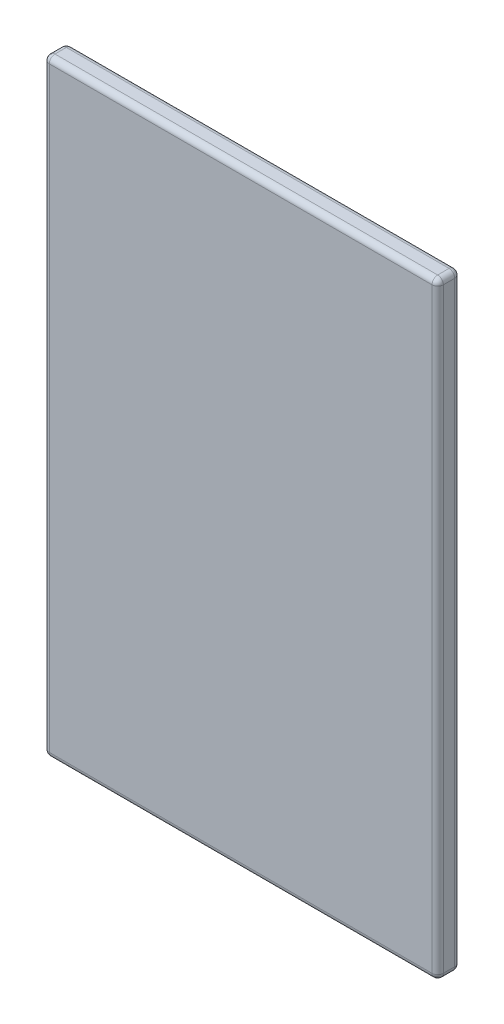
from build123d import *

# Parameters (mm, degrees)
SKETCH1_W           = 34.7
SKETCH1_H           = 53.5
BOSS_EXTRUDE1_DEPTH = 2
FILLET1_R           = 0.5


with BuildPart() as part:
    # Sketch1 → Boss-Extrude1 (new body)
    with BuildSketch(Plane.XY):
        Rectangle(SKETCH1_W, SKETCH1_H)
    extrude(amount=BOSS_EXTRUDE1_DEPTH)

    # Fillet1
    fillet1_edges = [part.edges().sort_by_distance(p)[0] for p in [
        (-17.35, 0, 2),
        (0, -26.75, 2),
        (17.35, 0, 2),
        (0, -26.75, 0),
        (-17.35, 0, 0),
        (0, 26.75, 0),
        (17.35, 0, 0),
        (17.35, -26.75, 1),
        (-17.35, -26.75, 1),
        (-17.35, 26.75, 1),
        (17.35, 26.75, 1),
        (0, 26.75, 2),
    ]]
    fillet(fillet1_edges, radius=FILLET1_R)


solid = part.part
